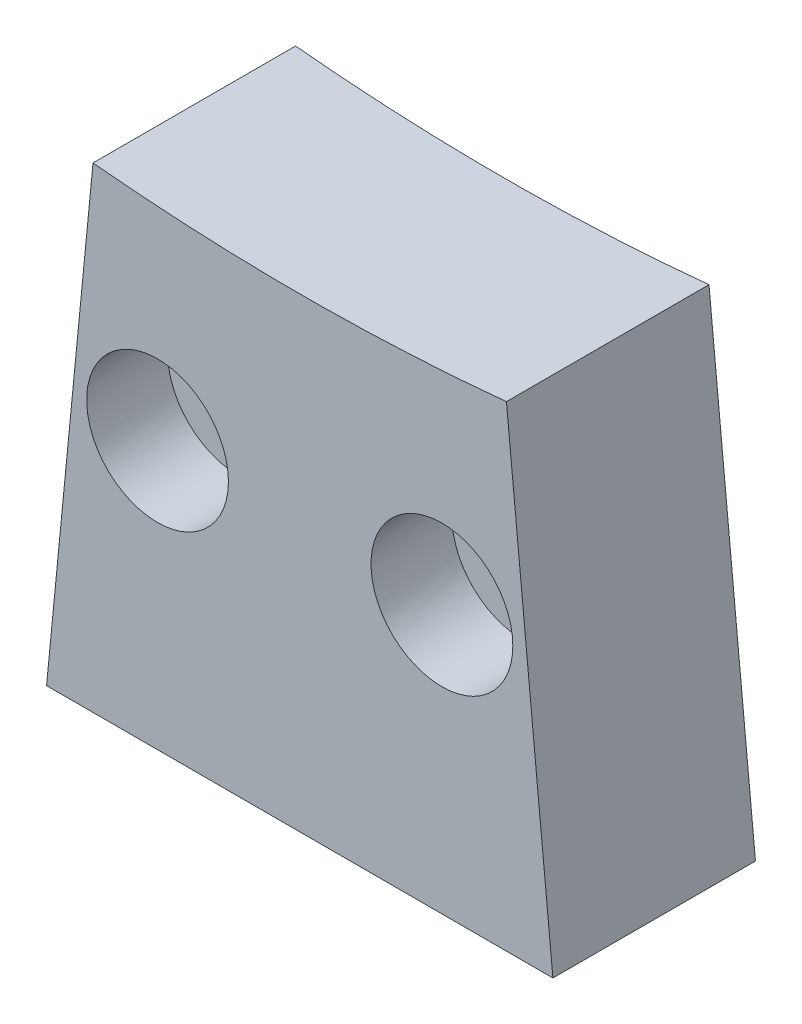
from build123d import *

# Parameters (mm, degrees)
BOSS_EXTRU_1_DEPTH      = 10
ESQUISSE2_R             = 1.025
ENL_V_MAT_EXTRU_1_DEPTH = 8
ENL_V_MAT_EXTRU_2_REACH = 130.997
ESQUISSE3_R             = 1.75
ESQUISSE4_R             = 3.5
ESQUISSE4_R_2           = 1.75
ENL_V_MAT_EXTRU_3_DEPTH = 4


with BuildPart() as part:
    # Esquisse1 → Boss.-Extru.1 (new body)
    with BuildSketch(Plane.XY):
        with BuildLine():
            Line((-12.5, -128), (12.5, -128))
            Line((12.5, -128), (10.205358779, -104.502873894))
            ThreePointArc((10.205358779, -104.502873894), (0, -105), (-10.205358779, -104.502873894))
            Line((-10.205358779, -104.502873894), (-12.5, -128))
        make_face()
    extrude(amount=BOSS_EXTRU_1_DEPTH)

    # Esquisse2 → Enlèv. mat.-Extru.1 (cut)
    with BuildSketch(Plane.XZ.offset(128)):
        with Locations((-4.75, 6)):
            Circle(ESQUISSE2_R)
        with Locations((4.75, 6)):
            Circle(ESQUISSE2_R)
    extrude(amount=-ENL_V_MAT_EXTRU_1_DEPTH, mode=Mode.SUBTRACT)

    # Esquisse3 → Enlèv. mat.-Extru.2 (cut, up to next)
    with BuildSketch(Plane.XY.offset(10), mode=Mode.PRIVATE) as enl_v_mat_extru_2_sk1:
        with Locations((-7.020582047, -114.785501819)):
            Circle(ESQUISSE3_R)
    enl_v_mat_extru_2_tool1 = extrude(enl_v_mat_extru_2_sk1.sketch, amount=-ENL_V_MAT_EXTRU_2_REACH, mode=Mode.PRIVATE) & part.part
    # Esquisse3 → Enlèv. mat.-Extru.2 (cut, up to next)
    with BuildSketch(Plane.XY.offset(10), mode=Mode.PRIVATE) as enl_v_mat_extru_2_sk2:
        with Locations((7.020582047, -114.785501819)):
            Circle(ESQUISSE3_R)
    enl_v_mat_extru_2_tool2 = extrude(enl_v_mat_extru_2_sk2.sketch, amount=-ENL_V_MAT_EXTRU_2_REACH, mode=Mode.PRIVATE) & part.part
    add(enl_v_mat_extru_2_tool1.solids().sort_by_distance((-7.020582, -114.785502, 10))[0], mode=Mode.SUBTRACT)
    add(enl_v_mat_extru_2_tool2.solids().sort_by_distance((7.020582, -114.785502, 10))[0], mode=Mode.SUBTRACT)

    # Esquisse4 → Enlèv. mat.-Extru.3 (cut)
    # profile 1 of 2: a face of its own
    with BuildSketch(Plane.XY.offset(10)):
        with Locations((7.020582047, -114.785501819)):
            Circle(ESQUISSE4_R)
        with Locations((7.020582047, -114.785501819)):
            Circle(ESQUISSE4_R_2, mode=Mode.SUBTRACT)
    # profile 2 of 2: a face of its own
    with BuildSketch(Plane.XY.offset(10)):
        with Locations((-7.020582047, -114.785501819)):
            Circle(ESQUISSE4_R)
    extrude(amount=-ENL_V_MAT_EXTRU_3_DEPTH, mode=Mode.SUBTRACT)


solid = part.part
